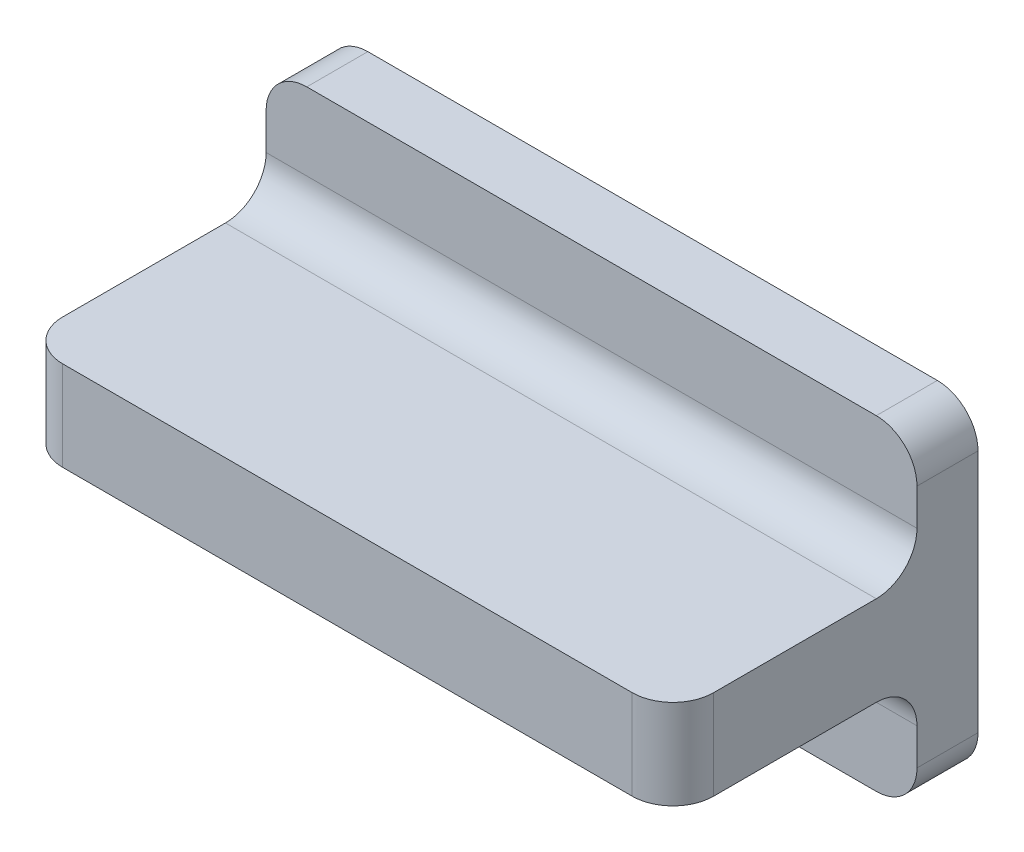
from build123d import *

# Parameters (mm, degrees)
SKETCH1_W           = 50.8
SKETCH1_H           = 25.4
BOSS_EXTRUDE1_DEPTH = 4.7625
SKETCH2_W           = 50.8
SKETCH2_H           = 7
BOSS_EXTRUDE2_DEPTH = 19.05
FILLET1_R           = 3.175


with BuildPart() as part:
    # Sketch1 → Boss-Extrude1 (new body)
    with BuildSketch(Plane.XY):
        Rectangle(SKETCH1_W, SKETCH1_H)
    extrude(amount=BOSS_EXTRUDE1_DEPTH)

    # Sketch2 → Boss-Extrude2 (add)
    with BuildSketch(Plane.XY.offset(4.7625)):
        Rectangle(SKETCH2_W, SKETCH2_H)
    extrude(amount=BOSS_EXTRUDE2_DEPTH)

    # Fillet1
    fillet1_edges = [part.edges().sort_by_distance(p)[0] for p in [
        (0, 3.5, 4.7625),
        (0, -3.5, 4.7625),
        (25.4, 0, 23.8125),
        (-25.4, 0, 23.8125),
        (25.4, -12.7, 2.38125),
        (-25.4, -12.7, 2.38125),
        (-25.4, 12.7, 2.38125),
        (25.4, 12.7, 2.38125),
    ]]
    fillet(fillet1_edges, radius=FILLET1_R)


solid = part.part
